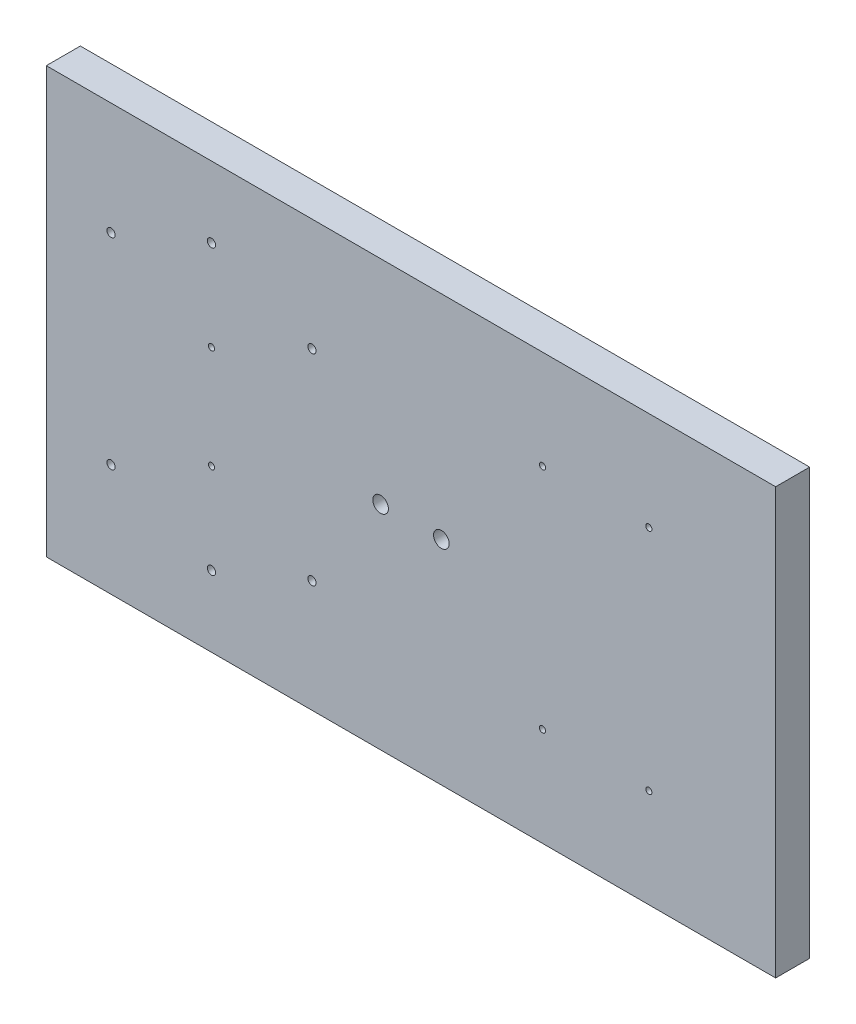
from build123d import *

# Parameters (mm, degrees)
SKETCH1_W                     = 304.8
SKETCH1_H                     = 177.8
BOSS_EXTRUDE1_DEPTH           = 14.224
TAP_DRILL_FOR_8_32_TAP1_D     = 3.4544
TAP_DRILL_FOR_8_32_TAP1_DEPTH = 7.874
TAP_DRILL_FOR_8_32_TAP1_TIP   = 1.037806461
TAP_DRILL_FOR_5_40_TAP1_D     = 2.5781
TAP_DRILL_FOR_5_40_TAP1_DEPTH = 7.874
TAP_DRILL_FOR_5_40_TAP1_TIP   = 0.774539381
F_1_4_CLEARANCE_HOLE1_D       = 6.5278


with BuildPart() as part:
    # Sketch1 → Boss-Extrude1 (new body)
    with BuildSketch(Plane.XY):
        Rectangle(SKETCH1_W, SKETCH1_H)
    extrude(amount=BOSS_EXTRUDE1_DEPTH)

    # Tap Drill for #8-32 Tap1
    with Locations(Plane.XY.offset(14.224)):
        with Locations((-41.39, 41.985), (-41.39, -41.985), (-125.36, -41.985), (-125.36, 41.985), (-83.375, 59.2455), (-83.375, -59.2455)):
            Hole(TAP_DRILL_FOR_8_32_TAP1_D / 2, depth=TAP_DRILL_FOR_8_32_TAP1_DEPTH)
            with Locations((0, 0, -(TAP_DRILL_FOR_8_32_TAP1_DEPTH + TAP_DRILL_FOR_8_32_TAP1_TIP / 2))):  # 118° drill point
                Cone(0, TAP_DRILL_FOR_8_32_TAP1_D / 2, TAP_DRILL_FOR_8_32_TAP1_TIP, mode=Mode.SUBTRACT)

    # Tap Drill for #5-40 Tap1
    with Locations(Plane.XY.offset(14.224)):
        with Locations((-83.375, 21.5), (-83.375, -21.5), (54.950719391, 47.625), (99.400719391, 47.625), (99.400719391, -47.625), (54.950719391, -47.625)):
            Hole(TAP_DRILL_FOR_5_40_TAP1_D / 2, depth=TAP_DRILL_FOR_5_40_TAP1_DEPTH)
            with Locations((0, 0, -(TAP_DRILL_FOR_5_40_TAP1_DEPTH + TAP_DRILL_FOR_5_40_TAP1_TIP / 2))):  # 118° drill point
                Cone(0, TAP_DRILL_FOR_5_40_TAP1_D / 2, TAP_DRILL_FOR_5_40_TAP1_TIP, mode=Mode.SUBTRACT)

    # 1/4 Clearance Hole1 (through all)
    with Locations(Plane(origin=(0, 0, 0), x_dir=(1, 0, 0), z_dir=(0, 0, -1))):
        with Locations((-12.7, 0), (12.7, 0)):
            Hole(F_1_4_CLEARANCE_HOLE1_D / 2)


solid = part.part
